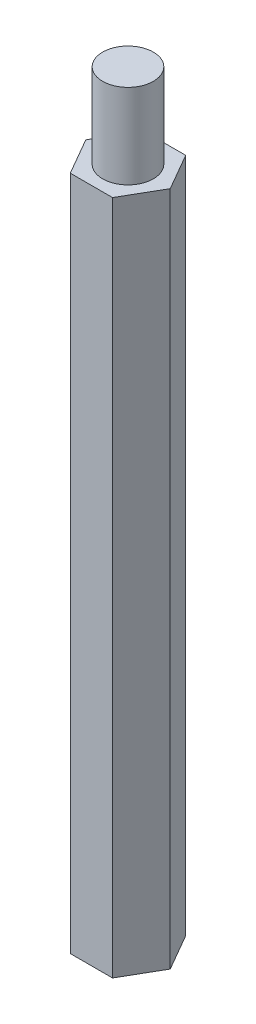
from build123d import *

# Parameters (mm, degrees)
EXTRUDE_1_DEPTH     = 40
SKETCH_2_R          = 1.5
EXTRUDE_2_DEPTH     = 5
SKETCH_3_R          = 1.5
CUT_EXTRUDE_1_DEPTH = 10


with BuildPart() as part:
    # Эскиз1 → Бобышка-Вытянуть1 (new body)
    with BuildSketch(Plane(origin=(0, 0, 0), x_dir=(1, 0, 0), z_dir=(0, 1, 0))):
        Polygon((1.25, -2.165063509), (2.5, 0), (1.25, 2.165063509), (-1.25, 2.165063509), (-2.5, 0), (-1.25, -2.165063509), align=None)
    extrude(amount=EXTRUDE_1_DEPTH)

    # Эскиз2 → Бобышка-Вытянуть2 (add)
    with BuildSketch(Plane(origin=(0, 40, 0), x_dir=(1, 0, 0), z_dir=(0, 1, 0))):
        with Locations(Location((0, 0, 0), (0, 0, 270))):
            Circle(SKETCH_2_R)
    extrude(amount=EXTRUDE_2_DEPTH)

    # Эскиз3 → Вырез-Вытянуть1 (cut)
    with BuildSketch(Plane.XZ):
        with Locations(Location((0, 0, 0), (0, 0, 90))):
            Circle(SKETCH_3_R)
    extrude(amount=-CUT_EXTRUDE_1_DEPTH, mode=Mode.SUBTRACT)


solid = part.part
